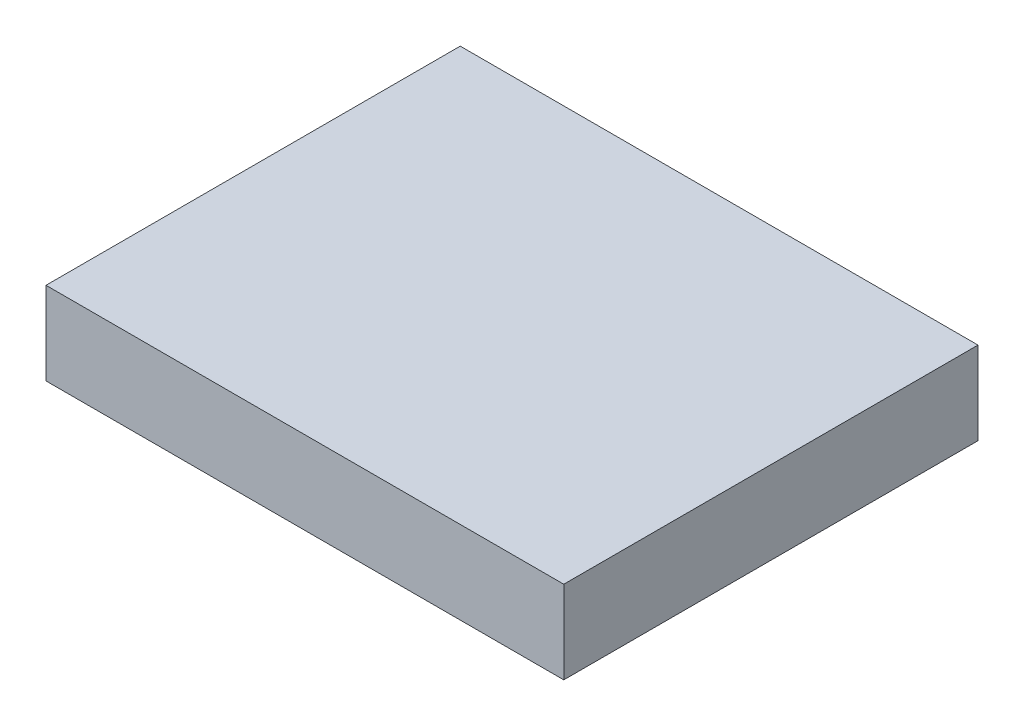
from build123d import *

# Parameters (mm, degrees)
SKETCH_1_W      = 25
SKETCH_1_H      = 20
EXTRUDE_1_DEPTH = 4


with BuildPart() as part:
    # 草图1 → 凸台-拉伸1 (new body)
    with BuildSketch(Plane(origin=(0, 0, 0), x_dir=(1, 0, 0), z_dir=(0, 1, 0))):
        with Locations((12.5, -10)):
            Rectangle(SKETCH_1_W, SKETCH_1_H)
    extrude(amount=EXTRUDE_1_DEPTH)


solid = part.part
